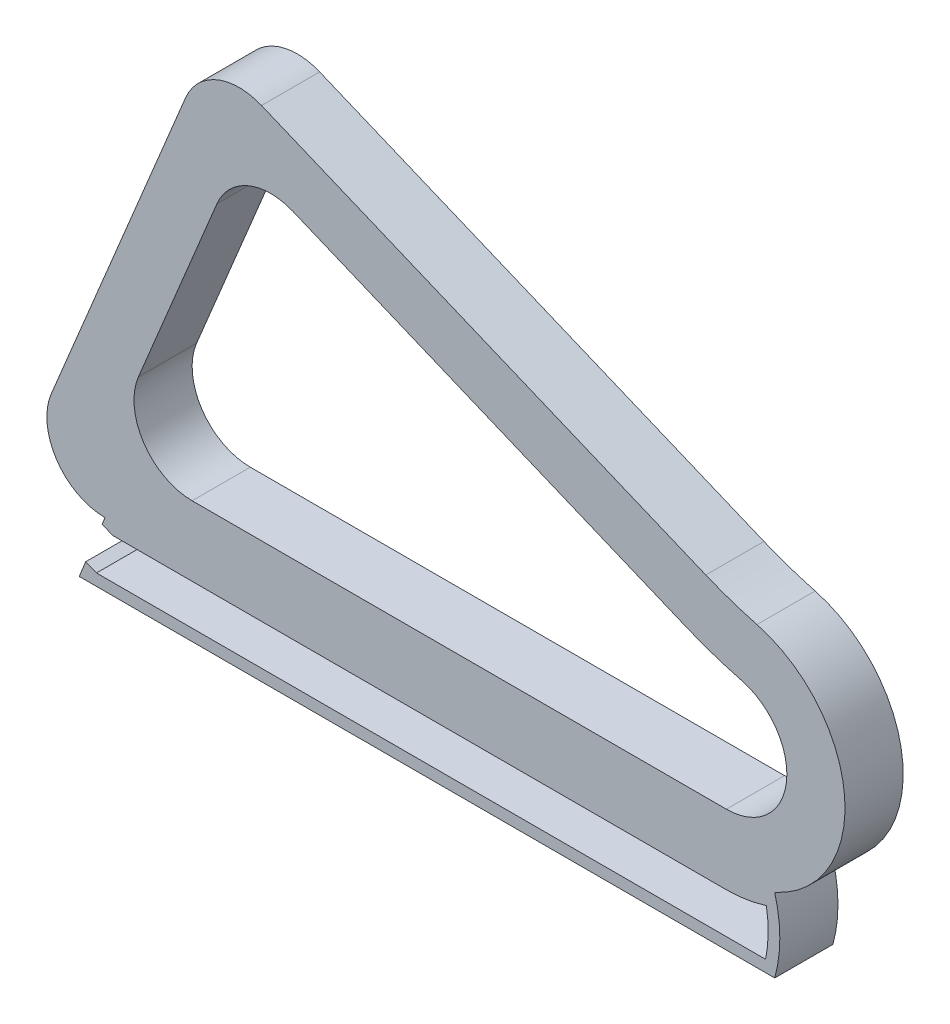
from build123d import *

# Parameters (mm, degrees)
BOSS_EXTRUDE3_DEPTH = 10
FILLET1_R           = 10
FILLET2_R           = 10
FILLET3_R           = 10
FILLET4_R           = 70
FILLET5_R           = 70
BOSS_EXTRUDE5_START = -10
BOSS_EXTRUDE5_DEPTH = 10
CUT_EXTRUDE1_REACH  = 123.684
SKETCH4_W           = 10
SKETCH4_H           = 7.527652991


with BuildPart() as part:
    # Sketch1 → Boss-Extrude3 (new body)
    with BuildSketch(Plane.XY):
        with BuildLine():
            Line((-76.083611013, -33.881828403), (45.731586831, -33.881828403))
            ThreePointArc((45.731586831, -33.881828403), (66.105293747, -14.631662941), (48.04052972, 6.80011497))
            Line((48.04052972, 6.80011497), (-43.429508159, 44.774039787))
            Line((-43.429508159, 44.774039787), (-76.083611013, -33.881828403))
        make_face()
        with BuildLine():
            Line((-61.104581002, -23.881828403), (45.731586831, -23.881828403))
            ThreePointArc((45.731586831, -23.881828403), (56.138081657, -13.475333577), (45.731586831, -3.068838752))
            Line((45.731586831, -3.068838752), (-38.028005668, 31.704082983))
            Line((-38.028005668, 31.704082983), (-61.104581002, -23.881828403))
        make_face(mode=Mode.SUBTRACT)
    extrude(amount=BOSS_EXTRUDE3_DEPTH)

    # Fillet1
    fillet1_edges = [part.edges().sort_by_distance(p)[0] for p in [
        (-76.083611013, -33.881828403, 5),
    ]]
    fillet(fillet1_edges, radius=FILLET1_R)

    # Fillet2
    fillet2_edges = [part.edges().sort_by_distance(p)[0] for p in [
        (-61.104581002, -23.881828403, 5),
    ]]
    fillet(fillet2_edges, radius=FILLET2_R)

    # Fillet3
    fillet3_edges = [part.edges().sort_by_distance(p)[0] for p in [
        (-38.028005668, 31.704082983, 5),
        (-43.429508159, 44.774039787, 5),
    ]]
    fillet(fillet3_edges, radius=FILLET3_R)

    # Fillet4
    fillet4_edges = [part.edges().sort_by_distance(p)[0] for p in [
        (48.04052972, 6.80011497, 5),
    ]]
    fillet(fillet4_edges, radius=FILLET4_R)

    # Fillet5
    fillet5_edges = [part.edges().sort_by_distance(p)[0] for p in [
        (45.731586831, -3.068838752, 5),
    ]]
    fillet(fillet5_edges, radius=FILLET5_R)

    # Sketch3 → Boss-Extrude5 (add)
    with BuildSketch(Plane.XY.offset(10).offset(BOSS_EXTRUDE5_START)):
        with BuildLine():
            Line((-61.104581002, -33.881828403), (45.731586831, -33.881828403))
            ThreePointArc((45.731586831, -33.881828403), (49.984539158, -33.433725987), (54.050711911, -32.109098334))
            ThreePointArc((54.050711911, -32.109098334), (54.926134679, -38.48550442), (54.050711911, -44.861910507))
            Line((54.050711911, -44.861910507), (41.297899737, -44.861910507))
            Line((41.297899737, -44.861910507), (-65.538268096, -44.861910507))
            Line((-65.538268096, -44.861910507), (-61.104581002, -33.881828403))
        make_face()
        with BuildLine():
            Line((-59.755272984, -35.881828403), (45.731586831, -35.881828403))
            ThreePointArc((45.731586831, -35.881828403), (49.213208875, -35.609680605), (52.610255818, -34.799848187))
            ThreePointArc((52.610255818, -34.799848187), (52.923282115, -38.83702206), (52.47940001, -42.861910507))
            Line((52.47940001, -42.861910507), (41.297899737, -42.861910507))
            Line((41.297899737, -42.861910507), (-62.5737856, -42.861910507))
            Line((-62.5737856, -42.861910507), (-59.755272984, -35.881828403))
        make_face(mode=Mode.SUBTRACT)
    extrude(amount=BOSS_EXTRUDE5_DEPTH)

    # Sketch4 → Cut-Extrude1 (cut, up to next)
    with BuildSketch(Plane(origin=(-38.920465473, 15.715835623, 0), x_dir=(0, 0, -1), z_dir=(0.9272587501851874, -0.37442116687629234, 0)), mode=Mode.PRIVATE) as cut_extrude1_sk1:
        with Locations((-5, -59.409204893)):
            Rectangle(SKETCH4_W, SKETCH4_H)
    cut_extrude1_tool1 = extrude(cut_extrude1_sk1.sketch, amount=-CUT_EXTRUDE1_REACH, mode=Mode.PRIVATE) & part.part
    add(cut_extrude1_tool1.solids().sort_by_distance((-61.164529, -39.371869, 5))[0], mode=Mode.SUBTRACT)


solid = part.part
